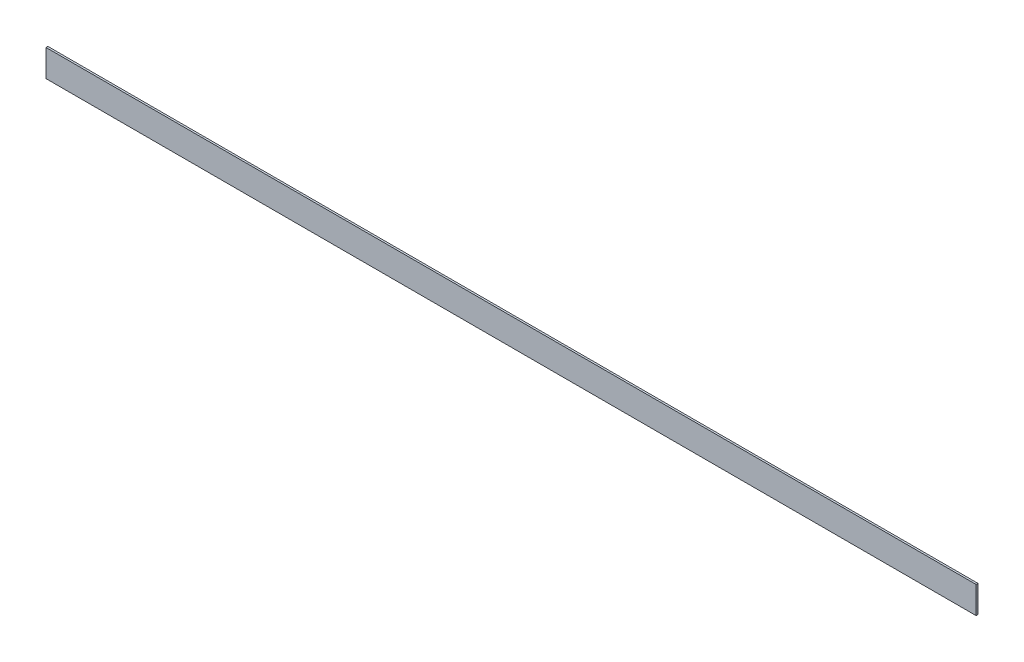
from build123d import *

# Parameters (mm, degrees)
SKETCH1_W           = 310
SKETCH1_H           = 0.63
BOSS_EXTRUDE1_DEPTH = 9


with BuildPart() as part:
    # Sketch1 → Boss-Extrude1 (new body)
    with BuildSketch(Plane(origin=(0, 0, 0), x_dir=(1, 0, 0), z_dir=(0, 1, 0))):
        Rectangle(SKETCH1_W, SKETCH1_H)
    extrude(amount=BOSS_EXTRUDE1_DEPTH)


solid = part.part
